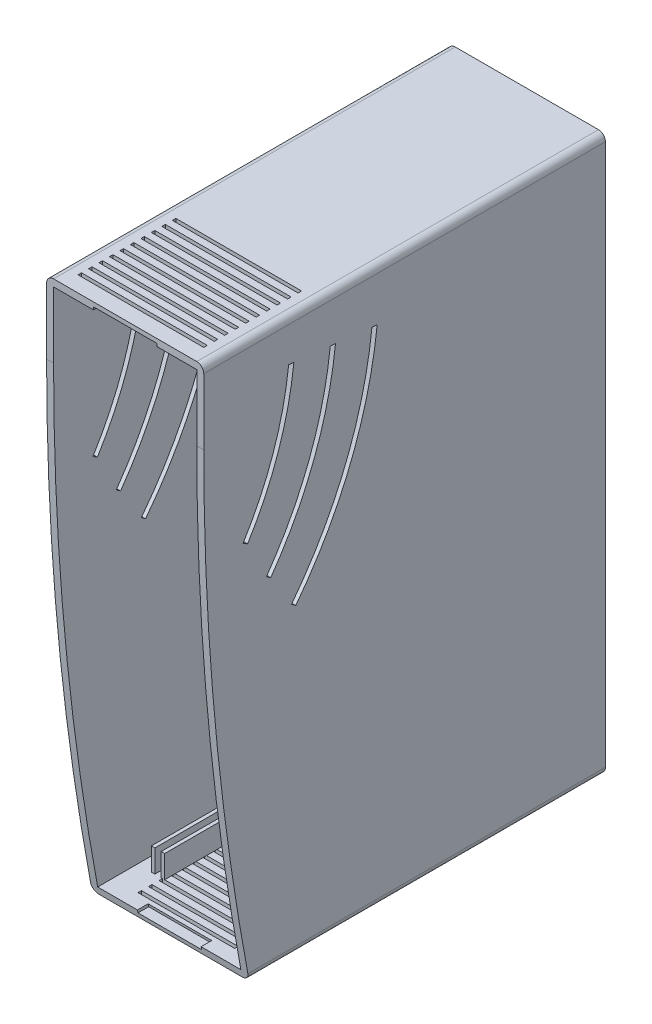
from build123d import *

# Parameters (mm, degrees)
SKETCH1_W               = 45
SKETCH1_H               = 159.1
BOSS_EXTRUDE1_DEPTH     = 115
SHELL1_T                = -2
CUT_EXTRUDE1_DEPTH      = 147.895209248
CUT_EXTRUDE1_DEPTH_BACK = 147.895209248
FILLET1_R               = 2
SKETCH3_W               = 36
SKETCH3_H               = 1
CUT_EXTRUDE2_DEPTH      = 4
LPATTERN1_COUNT         = 10
LPATTERN1_PITCH         = 3
SKETCH8_W               = 27.700077209
SKETCH8_H               = 1
CUT_EXTRUDE4_DEPTH      = 5
LPATTERN2_COUNT         = 10
LPATTERN2_PITCH         = 3
CUT_EXTRUDE3_DEPTH      = 147.895209411
SKETCH7_W               = 1
SKETCH7_H               = 6.5
BOSS_EXTRUDE3_DEPTH     = 90
CHAMFER2_SIZE           = 0.5
CUT_EXTRUDE6_DEPTH      = 9.105
SKETCH11_W              = 1
SKETCH11_H              = 6.5
BOSS_EXTRUDE6_DEPTH     = 89
SKETCH12_W              = 14.9796
SKETCH12_H              = 72.79
SKETCH12_W_2            = 14.049996967
SKETCH12_H_2            = 11.05
CUT_EXTRUDE7_DEPTH      = 2


with BuildPart() as part:
    # Sketch1 → Boss-Extrude1 (new body)
    with BuildSketch(Plane.XY):
        Rectangle(SKETCH1_W, SKETCH1_H)
    extrude(amount=BOSS_EXTRUDE1_DEPTH)

    # Shell1
    shell1_openings = [part.faces().sort_by_distance(p)[0] for p in [
        (0, 0, 115),
    ]]
    offset(amount=SHELL1_T, openings=shell1_openings, kind=Kind.INTERSECTION)

    # Sketch2 → Cut-Extrude1 (cut, two sides: drawn at the far end of the back side and taken through both)
    with BuildSketch(Plane(origin=(22.5, 0, 0), x_dir=(0, 0, -1), z_dir=(1, 0, 0)).offset(-CUT_EXTRUDE1_DEPTH_BACK)):
        with BuildLine():
            Line((-115, 482.170987722), (-115, 79.55))
            Line((-115, 79.55), (-115, 58.65))
            ThreePointArc((-115, 58.65), (-111.742842211, -10.755043044), (-102, -79.55))
            Line((-102, -79.55), (-26.918013628, -475.108282781))
            Line((-26.918013628, -475.108282781), (-828.772746701, -548.88921573))
            Line((-828.772746701, -548.88921573), (-916.854733073, 408.390054773))
            Line((-916.854733073, 408.390054773), (-115, 482.170987722))
        make_face()
    extrude(amount=CUT_EXTRUDE1_DEPTH + CUT_EXTRUDE1_DEPTH_BACK, mode=Mode.SUBTRACT)

    # Fillet1
    fillet1_edges = [part.edges().sort_by_distance(p)[0] for p in [
        (22.5, -79.55, 51),
        (-22.5, -79.55, 51),
        (-22.5, 79.55, 57.5),
        (22.5, 79.55, 57.5),
    ]]
    fillet(fillet1_edges, radius=FILLET1_R)

    # Sketch3 → Cut-Extrude2 (cut)
    with BuildSketch(Plane(origin=(0, 79.55, 0), x_dir=(1, 0, 0), z_dir=(0, 1, 0))):
        with Locations((0, -110)):
            Rectangle(SKETCH3_W, SKETCH3_H)
    cut_extrude2 = extrude(amount=-CUT_EXTRUDE2_DEPTH, mode=Mode.SUBTRACT)

    # LPattern1: Cut-Extrude2 ×10
    with Locations(*[(0, 0, -i * LPATTERN1_PITCH) for i in range(1, LPATTERN1_COUNT)]):
        add(cut_extrude2, mode=Mode.SUBTRACT)

    # Sketch8 → Cut-Extrude4 (cut)
    with BuildSketch(Plane.XZ.offset(79.55)):
        with Locations((0.524208986, 97.5)):
            Rectangle(SKETCH8_W, SKETCH8_H)
    cut_extrude4 = extrude(amount=-CUT_EXTRUDE4_DEPTH, mode=Mode.SUBTRACT)

    # LPattern2: Cut-Extrude4 ×10
    with Locations(*[(0, 0, -i * LPATTERN2_PITCH) for i in range(1, LPATTERN2_COUNT)]):
        add(cut_extrude4, mode=Mode.SUBTRACT)

    # Sketch5 → Cut-Extrude3 (cut, through all)
    with BuildSketch(Plane.ZY.offset(22.5)):
        with BuildLine():
            Line((65.347036406, 64.823533738), (66.838155653, 64.986516539))
            ThreePointArc((66.838155653, 64.986516539), (74.40797048, 34.807641847), (89.855449244, 7.799458383))
            Line((89.855449244, 7.799458383), (88.667189124, 6.88401429))
            ThreePointArc((88.667189124, 6.88401429), (73.01645406, 34.24756859), (65.347036406, 64.823533738))
        make_face()
        with BuildLine():
            Line((77.275990376, 66.127396149), (78.767109622, 66.29037895))
            ThreePointArc((78.767109622, 66.29037895), (84.83196797, 41.097147113), (97.049571899, 18.245197712))
            Line((97.049571899, 18.245197712), (95.827312392, 17.375668128))
            ThreePointArc((95.827312392, 17.375668128), (83.430037817, 40.563675608), (77.275990376, 66.127396149))
        make_face()
        with BuildLine():
            Line((89.204944346, 67.431258559), (90.696063592, 67.594241361))
            ThreePointArc((90.696063592, 67.594241361), (95.094328846, 47.99151385), (103.7314578, 29.852835107))
            Line((103.7314578, 29.852835107), (102.457595124, 29.060828868))
            ThreePointArc((102.457595124, 29.060828868), (93.67651402, 47.501818923), (89.204944346, 67.431258559))
        make_face()
    extrude(amount=-CUT_EXTRUDE3_DEPTH, mode=Mode.SUBTRACT)

    # Sketch7 → Boss-Extrude3 (add)
    with BuildSketch(Plane.XY.offset(95)):
        with Locations((-16, 74.3)):
            Rectangle(SKETCH7_W, SKETCH7_H)
        with Locations((-13.2, 74.3)):
            Rectangle(SKETCH7_W, SKETCH7_H)
    extrude(amount=-BOSS_EXTRUDE3_DEPTH)

    # Chamfer2
    chamfer2_edges = [part.edges().sort_by_distance(p)[0] for p in [
        (-13.7, 74.3, 95),
        (-15.5, 74.3, 95),
    ]]
    chamfer(chamfer2_edges, length=CHAMFER2_SIZE)

    # Sketch10 → Cut-Extrude6 (cut, symmetric)
    with BuildSketch(Plane(origin=(0, 0, 0), x_dir=(0, 0, -1), z_dir=(1, 0, 0))):
        with BuildLine():
            Line((-131.709183252, 78.35), (-112, 78.35))
            Line((-112, 78.35), (-112, 58.65))
            ThreePointArc((-112, 58.65), (-108.78648369, -10.149542881), (-99.173917094, -78.35))
            Line((-99.173917094, -78.35), (-102.923842912, -78.35))
            Line((-102.923842912, -78.35), (-131.709183252, 78.35))
        make_face()
    extrude(amount=CUT_EXTRUDE6_DEPTH, both=True, mode=Mode.SUBTRACT)

    # Sketch11 → Boss-Extrude6 (add)
    with BuildSketch(Plane.XY.offset(2)):
        with Locations((-16, -74.3)):
            Rectangle(SKETCH11_W, SKETCH11_H)
        with Locations((-13.2, -74.3)):
            Rectangle(SKETCH11_W, SKETCH11_H)
    extrude(amount=BOSS_EXTRUDE6_DEPTH)

    # Sketch12 → Cut-Extrude7 (cut)
    with BuildSketch(Plane(origin=(0, 0, 0), x_dir=(-1, 0, 0), z_dir=(0, 0, -1))):
        with Locations((8.5168, 0)):
            Rectangle(SKETCH12_W, SKETCH12_H)
        with Locations((10.674998484, -65.806322554)):
            Rectangle(SKETCH12_W_2, SKETCH12_H_2)
        with Locations((10.674998484, 65.795)):
            Rectangle(SKETCH12_W_2, SKETCH12_H_2)
    extrude(amount=-CUT_EXTRUDE7_DEPTH, mode=Mode.SUBTRACT)


solid = part.part
